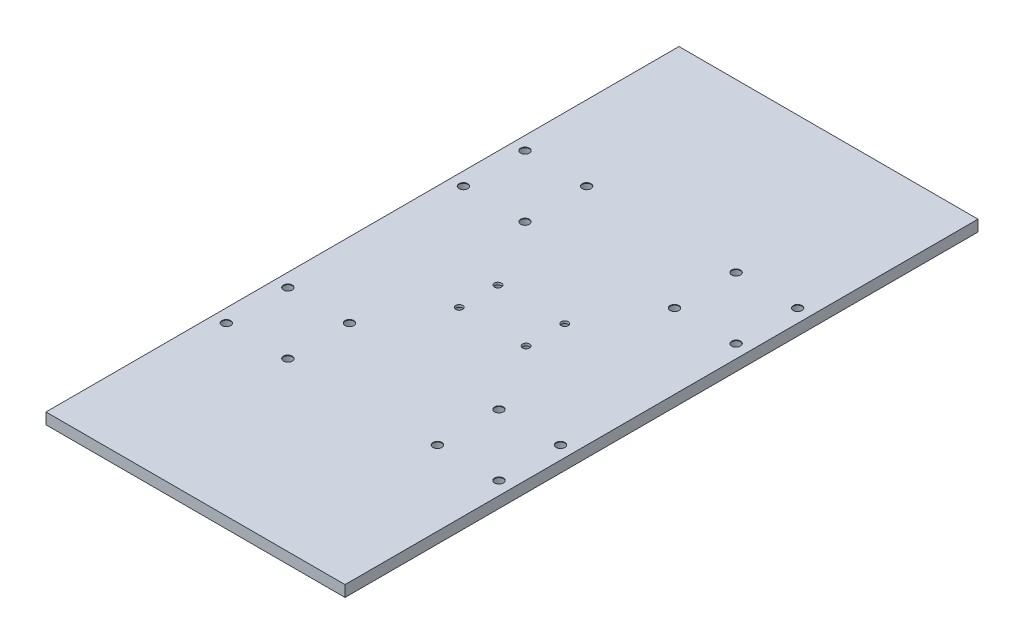
from build123d import *

# Parameters (mm, degrees)
SKETCH1_W        = 170
SKETCH1_H        = 359.85
EXTRUSION1_DEPTH = 6.35
HOLE2_D          = 4
HOLE2_DEPTH      = 8
HOLE2_TIP        = 1.201721238
HOLE3_D          = 5
HOLE3_DEPTH      = 8
HOLE3_TIP        = 1.502151548
HOLE4_D          = 9.75
HOLE4_DEPTH      = 5
HOLE5_D          = 11.2
HOLE5_DEPTH      = 6


with BuildPart() as part:
    # Sketch1 → Extrusion1 (new body)
    with BuildSketch(Plane(origin=(0, 0, 0), x_dir=(-1, 0, 0), z_dir=(0, 1, 0))):
        Rectangle(SKETCH1_W, SKETCH1_H)
    extrude(amount=EXTRUSION1_DEPTH)

    # Hole2
    with Locations(Plane(origin=(0, 0, 0), x_dir=(-1, 0, 0), z_dir=(0, -1, 0))):
        with Locations((19, -11), (-19, -11), (-19, 11), (19, 11)):
            Hole(HOLE2_D / 2, depth=HOLE2_DEPTH)
            with Locations((0, 0, -(HOLE2_DEPTH + HOLE2_TIP / 2))):  # 118° drill point
                Cone(0, HOLE2_D / 2, HOLE2_TIP, mode=Mode.SUBTRACT)

    # Hole3
    with Locations(Plane(origin=(0, 0, 0), x_dir=(-1, 0, 0), z_dir=(0, -1, 0))):
        with Locations((-42.5, -84.900000036), (-77.5, -84.900000036), (-42.5, -49.900000036), (-77.5, -49.900000036), (42.5, -49.900000036), (77.5, -49.900000036), (42.5, -84.900000036), (77.5, -84.900000036), (-77.5, 84.900000036), (-42.5, 84.900000036), (-77.5, 49.900000036), (-42.5, 49.900000036), (42.5, 84.900000036), (77.5, 84.900000036), (42.5, 49.900000036), (77.5, 49.900000036)):
            Hole(HOLE3_D / 2, depth=HOLE3_DEPTH)
            with Locations((0, 0, -(HOLE3_DEPTH + HOLE3_TIP / 2))):  # 118° drill point
                Cone(0, HOLE3_D / 2, HOLE3_TIP, mode=Mode.SUBTRACT)

    # Hole4
    with Locations(Plane(origin=(-19, 0, 11), x_dir=(0, 0, -1), z_dir=(0, -1, 0))):
        with Locations((0, 0), (0, 38), (22, 38), (22, 0)):
            Hole(HOLE4_D / 2, depth=HOLE4_DEPTH)

    # Hole5
    with Locations(Plane(origin=(-77.5, 0, 49.900000036), x_dir=(0, 0, -1), z_dir=(0, -1, 0))):
        with Locations((0, 0), (0, 35), (-35, 35), (-35, 0), (-35, 120), (-35, 155), (0, 155), (0, 120), (99.800000072, 155), (99.800000072, 120), (134.800000072, 120), (134.800000072, 155), (134.800000072, 35), (99.800000072, 35), (99.800000072, 0), (134.800000072, 0)):
            Hole(HOLE5_D / 2, depth=HOLE5_DEPTH)


solid = part.part
